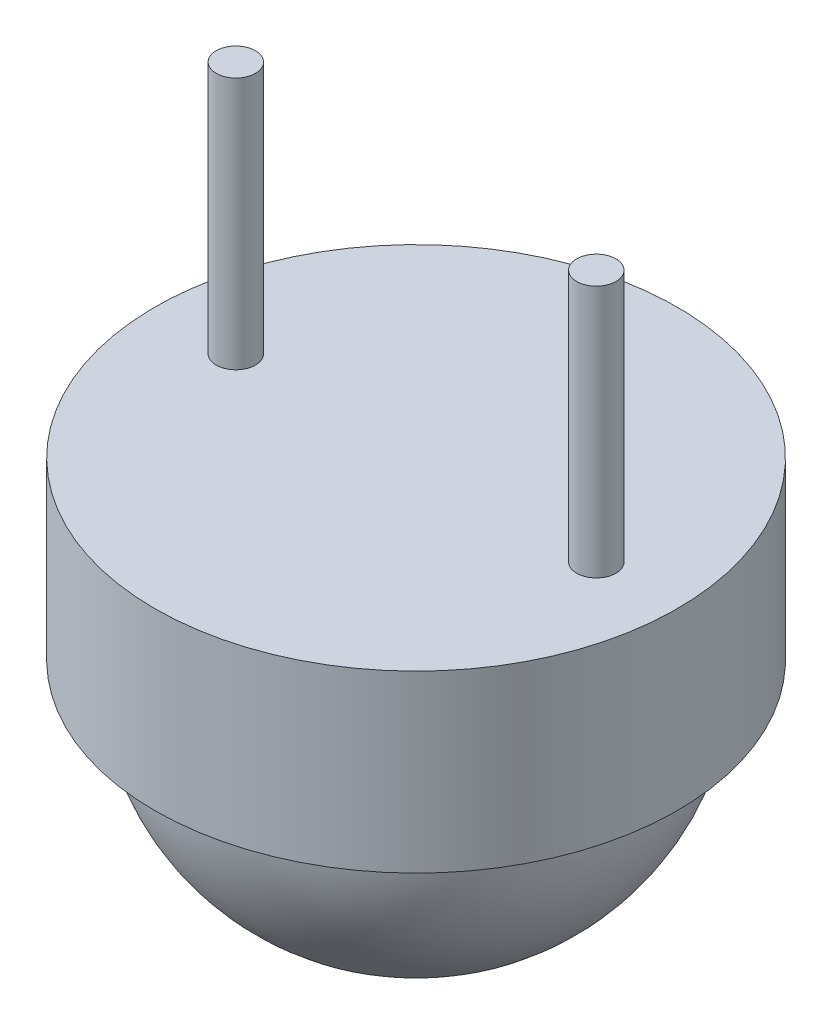
from build123d import *

# Parameters (mm, degrees)
SKETCH1_R           = 11.05
BOSS_EXTRUDE1_DEPTH = 7.4
SKETCH3_R           = 0.83
BOSS_EXTRUDE2_DEPTH = 10.69


with BuildPart() as part:
    # Sketch1 → Boss-Extrude1 (new body)
    with BuildSketch(Plane(origin=(0, 0, 0), x_dir=(1, 0, 0), z_dir=(0, 1, 0))):
        with Locations(Location((0, 0, 0), (0, 0, 270))):
            Circle(SKETCH1_R)
    extrude(amount=BOSS_EXTRUDE1_DEPTH)

    # Sketch2 → Revolve1 (revolve)
    with BuildSketch(Plane(origin=(0, 0, 0), x_dir=(0, 0, -1), z_dir=(1, 0, 0))):
        with BuildLine():
            Line((0, 0), (0, -9.525))
            ThreePointArc((0, -9.525), (6.735192091, -6.735192091), (9.525, 0))
            Line((9.525, 0), (0, 0))
        make_face()
    revolve(axis=Axis((0, 0, 0), (0, 1, 0)))

    # Sketch3 → Boss-Extrude2 (add)
    with BuildSketch(Plane(origin=(0, 7.4, 0), x_dir=(1, 0, 0), z_dir=(0, 1, 0))):
        with Locations(Location((7.625, 0, 0), (0, 0, 270))):
            Circle(SKETCH3_R)
    boss_extrude2 = extrude(amount=BOSS_EXTRUDE2_DEPTH)

    # Mirror1: Boss-Extrude2 across plane
    add(boss_extrude2.mirror(Plane(origin=(0, 0, 0), x_dir=(0, 0, 1), z_dir=(1, 0, 0))))


solid = part.part
